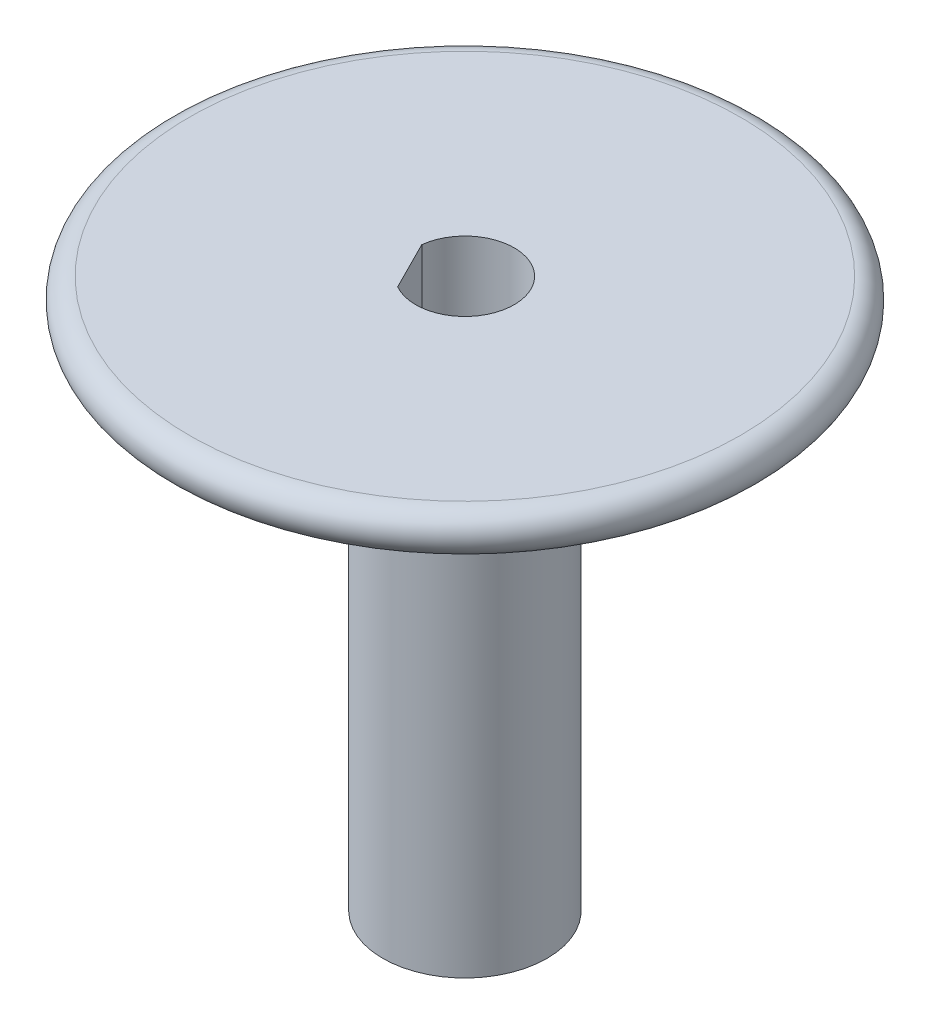
from build123d import *

# Parameters (mm, degrees)
CUT_EXTRUDE1_DEPTH = 43.728464961


with BuildPart() as part:
    # Sketch1 → Revolve1 (revolve)
    with BuildSketch(Plane.XY):
        with BuildLine():
            Line((0, -15.723376421), (0, 18.263376421))
            Line((0, 18.263376421), (17.041503786, 18.263376421))
            ThreePointArc((17.041503786, 18.263376421), (18.311503786, 16.993376421), (17.041503786, 15.723376421))
            Line((17.041503786, 15.723376421), (5.08, 15.723376421))
            Line((5.08, 15.723376421), (5.08, -15.723376421))
            Line((5.08, -15.723376421), (0, -15.723376421))
        make_face()
    revolve(axis=Axis((0, -15.723376421, 0), (0, 1, 0)))

    # Sketch2 → Cut-Extrude1 (cut, through all)
    with BuildSketch(Plane(origin=(0, 18.263376421, 0), x_dir=(1, 0, 0), z_dir=(0, 1, 0))):
        with BuildLine():
            Line((-1.511765747, -2.646660354), (-3.026830512, 0.358529991))
            ThreePointArc((-3.026830512, 0.358529991), (2.721673429, 1.372129896), (-1.511765747, -2.646660354))
        make_face()
    extrude(amount=-CUT_EXTRUDE1_DEPTH, mode=Mode.SUBTRACT)


solid = part.part
